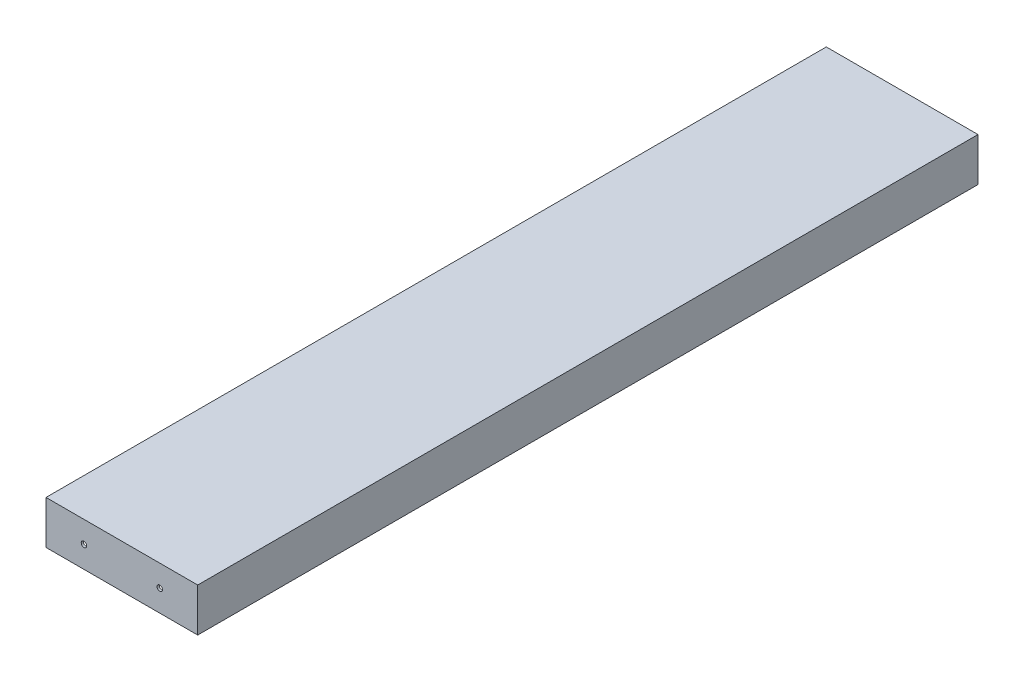
from build123d import *

# Parameters (mm, degrees)
SKETCH1_W           = 177.8
SKETCH1_H           = 50.8
BOSS_EXTRUDE1_DEPTH = 914.4
SHELL1_T            = -2.54
SKETCH2_R           = 3.175
CUT_EXTRUDE1_DEPTH  = 945.134


with BuildPart() as part:
    # Sketch1 → Boss-Extrude1 (new body)
    with BuildSketch(Plane.XY):
        with Locations((88.9, 25.4)):
            Rectangle(SKETCH1_W, SKETCH1_H)
    extrude(amount=BOSS_EXTRUDE1_DEPTH)

    # Shell1
    shell1_openings = [part.faces().sort_by_distance(p)[0] for p in [
        (88.9, 0, 457.2),
    ]]
    offset(amount=SHELL1_T, openings=shell1_openings, kind=Kind.INTERSECTION)

    # Sketch2 → Cut-Extrude1 (cut)
    with BuildSketch(Plane(origin=(0, 0, 0), x_dir=(-1, 0, 0), z_dir=(0, 0, -1))):
        with Locations((-133.35, 25.4)):
            Circle(SKETCH2_R)
        with Locations((-44.45, 25.4)):
            Circle(SKETCH2_R)
    extrude(amount=-CUT_EXTRUDE1_DEPTH, mode=Mode.SUBTRACT)


solid = part.part
